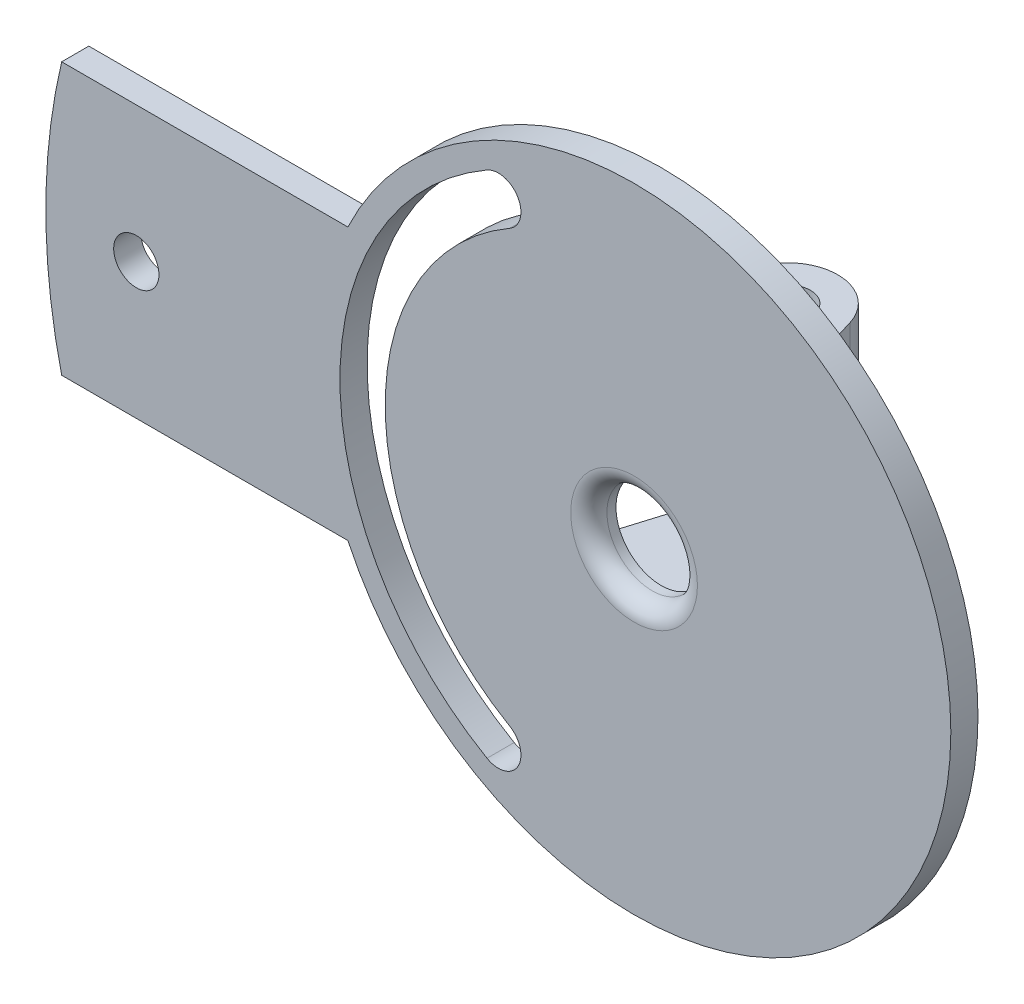
from build123d import *

# Parameters (mm, degrees)
SKETCH_1_R          = 5
SKETCH_1_R_2        = 2.5
EXTRUDE_1_DEPTH     = 3
SKETCH_3_R          = 2.5
EXTRUDE_2_DEPTH     = 15
SKETCH_4_W          = 25
SKETCH_4_H          = 12
CUT_EXTRUDE_1_DEPTH = 10
FILLET_1_R          = 2


with BuildPart() as part:
    # 스케치1 → 보스-돌출1 (new body)
    with BuildSketch(Plane.XY):
        with BuildLine():
            ThreePointArc((-31.622776602, -15), (35, 0), (-31.622776602, 15))
            Line((-31.622776602, 15), (-63.245553203, 15))
            ThreePointArc((-63.245553203, 15), (-65, 0), (-63.245553203, -15))
            Line((-63.245553203, -15), (-31.622776602, -15))
        make_face()
        with BuildLine():
            ThreePointArc((-13.750000001, -23.815698604), (-12.834936371, -27.230761907), (-16.249999587, -28.145825861))
            ThreePointArc((-16.249999587, -28.145825861), (-32.5, -2.35e-07), (-16.249999995, 28.145825626))
            ThreePointArc((-16.249999995, 28.145825626), (-12.834936369, 27.230761903), (-13.750000416, 23.815698364))
            ThreePointArc((-13.750000416, 23.815698364), (-27.5, -2.4e-07), (-13.750000001, -23.815698604))
        make_face(mode=Mode.SUBTRACT)
        Circle(SKETCH_1_R, mode=Mode.SUBTRACT)
        with Locations((-55, 0)):
            Circle(SKETCH_1_R_2, mode=Mode.SUBTRACT)
    extrude(amount=EXTRUDE_1_DEPTH)

    # 스케치3 → 보스-돌출2 (add, symmetric)
    with BuildSketch(Plane(origin=(0, 0, 0), x_dir=(1, 0, 0), z_dir=(0, 1, 0))):
        with BuildLine():
            Line((-10, 0), (10, 0))
            Line((10, 0), (5.262640911, 15.598314937))
            ThreePointArc((5.262640911, 15.598314937), (0, 19.5), (-5.262640911, 15.598314937))
            Line((-5.262640911, 15.598314937), (-10, 0))
        make_face()
        with Locations(Location((0, 14, 0), (0, 0, 270))):
            Circle(SKETCH_3_R, mode=Mode.SUBTRACT)
    extrude(amount=EXTRUDE_2_DEPTH, both=True)

    # 스케치4 → 컷-돌출1 (cut, symmetric)
    with BuildSketch(Plane(origin=(0, 0, 0), x_dir=(0, 0, -1), z_dir=(1, 0, 0))):
        with Locations((12.5, 0)):
            Rectangle(SKETCH_4_W, SKETCH_4_H)
    extrude(amount=CUT_EXTRUDE_1_DEPTH, both=True, mode=Mode.SUBTRACT)

    # 필렛1
    fillet_1_edges = [part.edges().sort_by_distance(p)[0] for p in [
        (-5, 0, 3),
    ]]
    fillet(fillet_1_edges, radius=FILLET_1_R)


solid = part.part
